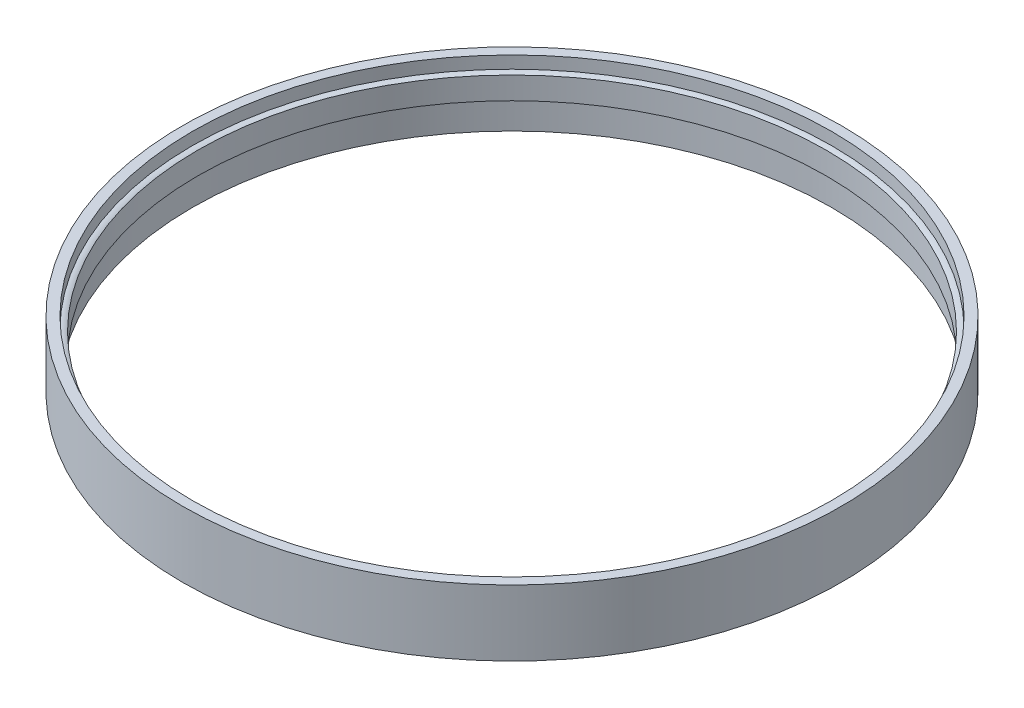
from build123d import *


with BuildPart() as part:
    # Esquisse1 → Révolution1 (revolve)
    with BuildSketch(Plane.XY, mode=Mode.PRIVATE) as r_volution1_sk:
        with BuildLine():
            Line((-40, 8), (-40, 0))
            Line((-40, 0), (-38.8, 0))
            Line((-38.8, 0), (-38.8, 3.5))
            ThreePointArc((-38.8, 3.5), (-38.46666524, 3.537506261), (-38.15, 3.648149417))
            Line((-38.15, 3.648149417), (-38.15, 6.351850583))
            ThreePointArc((-38.15, 6.351850583), (-38.46666524, 6.462493739), (-38.8, 6.5))
            Line((-38.8, 6.5), (-38.8, 8))
            Line((-38.8, 8), (-40, 8))
        make_face()
    revolve(r_volution1_sk.sketch.rotate(Axis((0, 0, 0), (0, 1, 0)), 270), axis=Axis((0, 0, 0), (0, 1, 0)))


solid = part.part
